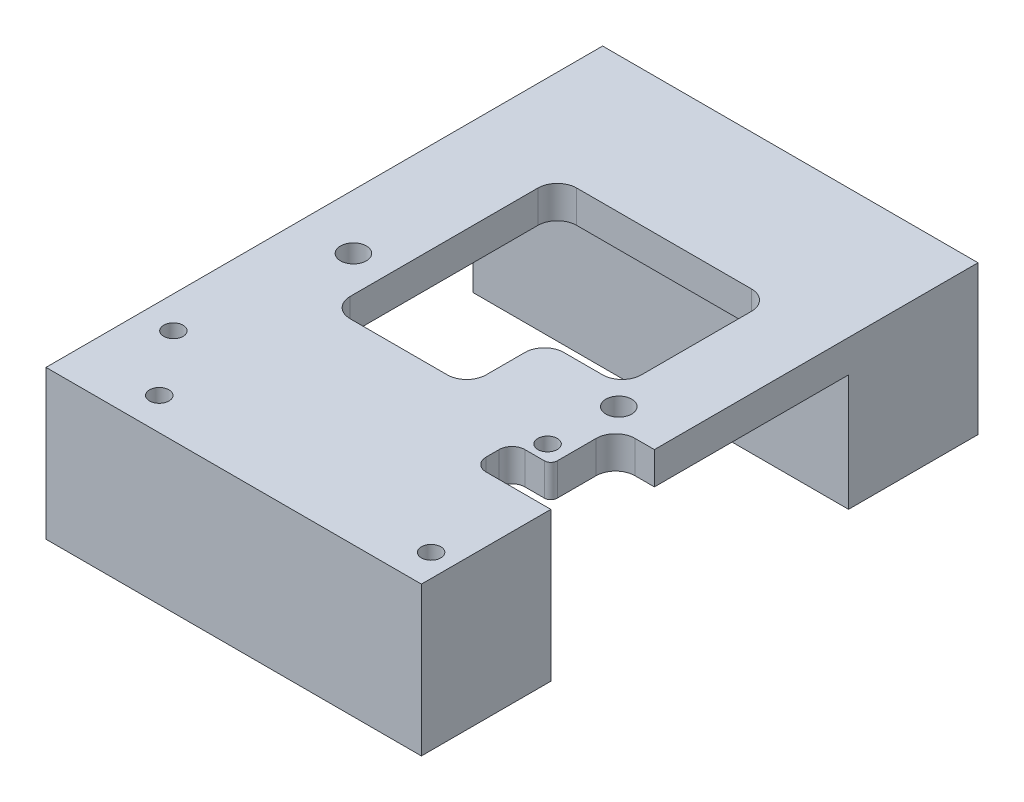
from build123d import *

# Parameters (mm, degrees)
SKETCH1_W               = 58
SKETCH1_H               = 86
BOSS_EXTRUDE1_DEPTH     = 23
CUT_EXTRUDE1_DEPTH      = 23
CUT_EXTRUDE2_DEPTH      = 23
FILLET1_R               = 3
FILLET2_R               = 2
FILLET3_R               = 2
FILLET4_R               = 1
FILLET5_R               = 3
FILLET6_R               = 3
FILLET7_R               = 3
FILLET8_R               = 3
FILLET9_R               = 3
FILLET10_R              = 3
CUT_EXTRUDE3_DEPTH      = 57.73623181
CUT_EXTRUDE3_DEPTH_BACK = 57.73623181
SKETCH4_W               = 46
SKETCH4_H               = 18
CUT_EXTRUDE4_DEPTH      = 57.73623181
CUT_EXTRUDE4_DEPTH_BACK = 57.73623181
SKETCH5_R               = 2
SKETCH5_R_2             = 1.5
SKETCH6_R               = 1.5
CUT_EXTRUDE11_DEPTH     = 10
SKETCH7_R               = 1.5
CUT_EXTRUDE12_DEPTH     = 10


with BuildPart() as part:
    # Sketch1 → Boss-Extrude1 (new body)
    with BuildSketch(Plane(origin=(0, 0, 0), x_dir=(1, 0, 0), z_dir=(0, 1, 0))):
        Rectangle(SKETCH1_W, SKETCH1_H)
    extrude(amount=BOSS_EXTRUDE1_DEPTH)

    # Sketch2 → Cut-Extrude1 (cut)
    with BuildSketch(Plane(origin=(0, 0, 0), x_dir=(1, 0, 0), z_dir=(0, 1, 0))):
        Polygon((29, -23), (17, -23), (17, -17), (23, -17), (23, -7), (29, -7), align=None)
    extrude(amount=CUT_EXTRUDE1_DEPTH, mode=Mode.SUBTRACT)

    # Sketch3 → Cut-Extrude2 (cut)
    with BuildSketch(Plane(origin=(0, 0, 0), x_dir=(1, 0, 0), z_dir=(0, 1, 0))):
        Polygon((-15, -13), (-15, 22), (18, 22), (18, -1), (6, -1), (6, -13), align=None)
    extrude(amount=CUT_EXTRUDE2_DEPTH, mode=Mode.SUBTRACT)

    # Fillet1
    fillet1_edges = [part.edges().sort_by_distance(p)[0] for p in [
        (23, 11.5, 7),
    ]]
    fillet(fillet1_edges, radius=FILLET1_R)

    # Fillet2
    fillet2_edges = [part.edges().sort_by_distance(p)[0] for p in [
        (17, 11.5, 17),
    ]]
    fillet(fillet2_edges, radius=FILLET2_R)

    # Fillet3
    fillet3_edges = [part.edges().sort_by_distance(p)[0] for p in [
        (17, 11.5, 23),
    ]]
    fillet(fillet3_edges, radius=FILLET3_R)

    # Fillet4
    fillet4_edges = [part.edges().sort_by_distance(p)[0] for p in [
        (23, 11.5, 17),
    ]]
    fillet(fillet4_edges, radius=FILLET4_R)

    # Fillet5
    fillet5_edges = [part.edges().sort_by_distance(p)[0] for p in [
        (-15, 11.5, 13),
    ]]
    fillet(fillet5_edges, radius=FILLET5_R)

    # Fillet6
    fillet6_edges = [part.edges().sort_by_distance(p)[0] for p in [
        (6, 11.5, 13),
    ]]
    fillet(fillet6_edges, radius=FILLET6_R)

    # Fillet7
    fillet7_edges = [part.edges().sort_by_distance(p)[0] for p in [
        (-15, 11.5, -22),
    ]]
    fillet(fillet7_edges, radius=FILLET7_R)

    # Fillet8
    fillet8_edges = [part.edges().sort_by_distance(p)[0] for p in [
        (18, 11.5, -22),
    ]]
    fillet(fillet8_edges, radius=FILLET8_R)

    # Fillet9
    fillet9_edges = [part.edges().sort_by_distance(p)[0] for p in [
        (18, 11.5, 1),
    ]]
    fillet(fillet9_edges, radius=FILLET9_R)

    # Fillet10
    fillet10_edges = [part.edges().sort_by_distance(p)[0] for p in [
        (6, 11.5, 1),
    ]]
    fillet(fillet10_edges, radius=FILLET10_R)

    # Sketch4 → Cut-Extrude3 (cut, two sides: drawn at the far end of the back side and taken through both)
    with BuildSketch(Plane(origin=(0, 0, 0), x_dir=(0, 0, -1), z_dir=(1, 0, 0)).offset(-CUT_EXTRUDE3_DEPTH_BACK)):
        with Locations((0, 9)):
            Rectangle(SKETCH4_W, SKETCH4_H)
    extrude(amount=CUT_EXTRUDE3_DEPTH + CUT_EXTRUDE3_DEPTH_BACK, mode=Mode.SUBTRACT)

    # Sketch5 → Cut-Extrude4 (cut, two sides: drawn at the far end of the back side and taken through both)
    with BuildSketch(Plane(origin=(0, 0, 0), x_dir=(1, 0, 0), z_dir=(0, 1, 0)).offset(-CUT_EXTRUDE4_DEPTH_BACK)):
        with Locations(Location((20.5, -4, 0), (0, 0, 270))):
            Circle(SKETCH5_R)
        with Locations(Location((-20.5, -4, 0), (0, 0, 270))):
            Circle(SKETCH5_R)
        with Locations(Location((20, -14.5, 0), (0, 0, 270))):
            Circle(SKETCH5_R_2)
        with Locations(Location((-16.5, -38, 0), (0, 0, 270))):
            Circle(SKETCH5_R_2)
        with Locations(Location((25.5, -38, 0), (0, 0, 270))):
            Circle(SKETCH5_R_2)
        with Locations(Location((-24.051636808, -28.259079953, 0), (0, 0, 270))):
            Circle(SKETCH5_R_2)
    extrude(amount=CUT_EXTRUDE4_DEPTH + CUT_EXTRUDE4_DEPTH_BACK, mode=Mode.SUBTRACT)

    # Sketch6 → Cut-Extrude11 (cut)
    with BuildSketch(Plane.ZY.offset(29)):
        with Locations((40, 3)):
            Circle(SKETCH6_R)
        with Locations((26, 18)):
            Circle(SKETCH6_R)
    extrude(amount=-CUT_EXTRUDE11_DEPTH, mode=Mode.SUBTRACT)

    # Sketch7 → Cut-Extrude12 (cut)
    with BuildSketch(Plane(origin=(0, 0, -43), x_dir=(-1, 0, 0), z_dir=(0, 0, -1))):
        with Locations((-19.5, 4.5)):
            Circle(SKETCH7_R)
        with Locations((-19.5, 18.5)):
            Circle(SKETCH7_R)
    extrude(amount=-CUT_EXTRUDE12_DEPTH, mode=Mode.SUBTRACT)


solid = part.part
